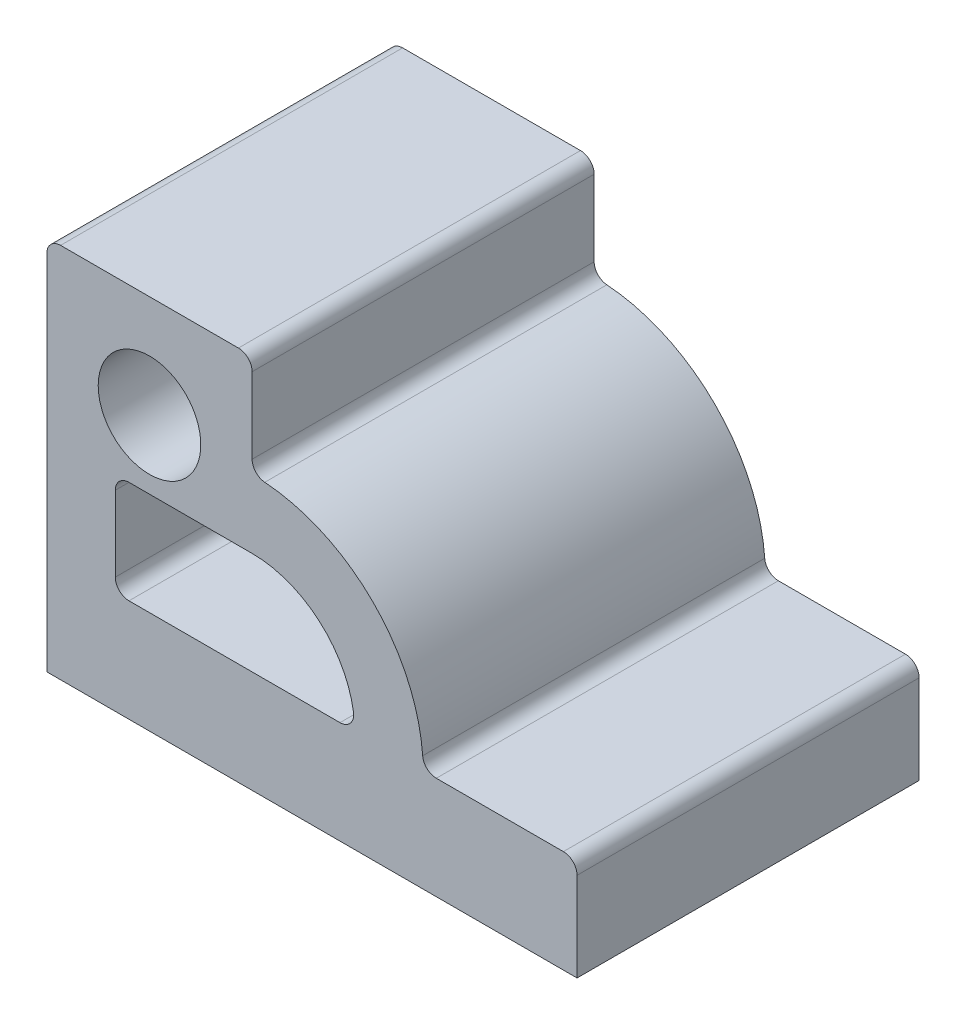
from build123d import *

# Parameters (mm, degrees)
SKETCH1_R           = 15
BOSS_EXTRUDE1_DEPTH = 100


with BuildPart() as part:
    # Sketch1 → Boss-Extrude1 (new body)
    with BuildSketch(Plane.XY):
        with BuildLine():
            Line((70.134297521, 0), (-84.865702479, 0))
            Line((-84.865702479, 0), (-84.865702479, 106))
            ThreePointArc((-84.865702479, 106), (-83.694129604, 108.828427125), (-80.865702479, 110))
            Line((-80.865702479, 110), (-28.865702479, 110))
            ThreePointArc((-28.865702479, 110), (-26.037275355, 108.828427125), (-24.865702479, 106))
            Line((-24.865702479, 106), (-24.865702479, 83.851648071))
            ThreePointArc((-24.865702479, 83.851648071), (-23.797014915, 81.129992802), (-21.161998776, 79.862637103))
            ThreePointArc((-21.161998776, 79.862637103), (10.48963658, 65.355339059), (24.996934624, 33.703703704))
            ThreePointArc((24.996934624, 33.703703704), (26.264290322, 31.068687565), (28.985945592, 30))
            Line((28.985945592, 30), (66.134297521, 30))
            ThreePointArc((66.134297521, 30), (68.962724645, 28.828427125), (70.134297521, 26))
            Line((70.134297521, 26), (70.134297521, 0))
        make_face()
        with Locations(Location((-54.865702479, 80, 0), (0, 0, 180))):
            Circle(SKETCH1_R, mode=Mode.SUBTRACT)
        with BuildLine():
            Line((0.824762678, 30), (-60.865702479, 30))
            ThreePointArc((-60.865702479, 30), (-63.694129604, 31.171572875), (-64.865702479, 34))
            Line((-64.865702479, 34), (-64.865702479, 56))
            ThreePointArc((-64.865702479, 56), (-63.694129604, 58.828427125), (-60.865702479, 60))
            Line((-60.865702479, 60), (-24.865702479, 60))
            ThreePointArc((-24.865702479, 60), (-5.352393412, 52.786635759), (4.777141933, 34.615384615))
            ThreePointArc((4.777141933, 34.615384615), (3.862980779, 31.398225458), (0.824762678, 30))
        make_face(mode=Mode.SUBTRACT)
    extrude(amount=BOSS_EXTRUDE1_DEPTH)


solid = part.part
